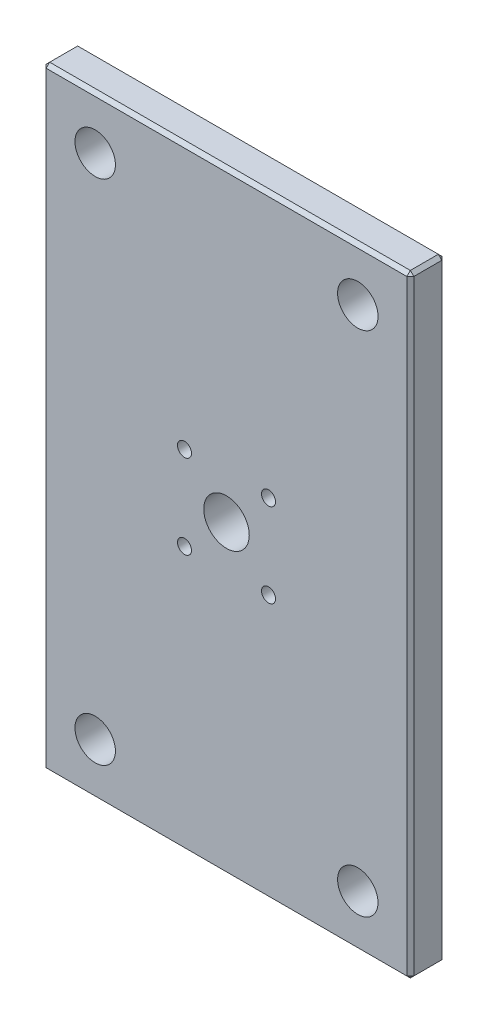
from build123d import *

# Parameters (mm, degrees)
SKETCH_1_W             = 420
SKETCH_1_H             = 700
EXTRUDE_1_DEPTH        = 40
SKETCH_2_R             = 23.1
CUT_EXTRUDE_1_DEPTH    = 818.312669668
SKETCH_3_R             = 26
CUT_EXTRUDE_2_DEPTH    = 818.312669668
M18X2_0_1_D            = 16
CHAMFER_1_SIZE         = 4
HOLE_WIZARD_M4_1_D     = 3.3
HOLE_WIZARD_M4_1_DEPTH = 10.1
HOLE_WIZARD_M4_1_TIP   = 0.991420021


with BuildPart() as part:
    # 草图1 → 凸台-拉伸1 (new body)
    with BuildSketch(Plane.XY):
        with Locations((210, 350)):
            Rectangle(SKETCH_1_W, SKETCH_1_H)
    extrude(amount=EXTRUDE_1_DEPTH)

    # 草图2 → 切除-拉伸1 (cut, through all)
    with BuildSketch(Plane.XY.offset(40)):
        with Locations((60, 60)):
            Circle(SKETCH_2_R)
        with Locations((360, 60)):
            Circle(SKETCH_2_R)
        with Locations((360, 640)):
            Circle(SKETCH_2_R)
        with Locations((60, 640)):
            Circle(SKETCH_2_R)
    extrude(amount=-CUT_EXTRUDE_1_DEPTH, mode=Mode.SUBTRACT)

    # 草图3 → 切除-拉伸2 (cut, through all)
    with BuildSketch(Plane.XY.offset(40)):
        with Locations((210, 350)):
            Circle(SKETCH_3_R)
    extrude(amount=-CUT_EXTRUDE_2_DEPTH, mode=Mode.SUBTRACT)

    # M18x2.0 螺纹孔1 (through all)
    with Locations(Plane.XY.offset(40)):
        with Locations((162, 398), (258, 398), (258, 302), (162, 302)):
            Hole(M18X2_0_1_D / 2)

    # 倒角1
    chamfer_1_edges = [part.edges().sort_by_distance(p)[0] for p in [
        (420, 350, 40),
        (210, 700, 40),
        (0, 350, 40),
        (210, 700, 0),
        (420, 350, 0),
        (210, 0, 0),
        (0, 350, 0),
        (210, 0, 40),
        (0, 700, 20),
        (420, 700, 20),
        (420, 0, 20),
        (0, 0, 20),
    ]]
    chamfer(chamfer_1_edges, length=CHAMFER_1_SIZE)

    # M4 螺纹孔1
    with Locations(Plane(origin=(0, 0, 0), x_dir=(-1, 0, 0), z_dir=(0, -1, 0))):
        with Locations((-237, -20), (-183, -20)):
            Hole(HOLE_WIZARD_M4_1_D / 2, depth=HOLE_WIZARD_M4_1_DEPTH)
            with Locations((0, 0, -(HOLE_WIZARD_M4_1_DEPTH + HOLE_WIZARD_M4_1_TIP / 2))):  # 118° drill point
                Cone(0, HOLE_WIZARD_M4_1_D / 2, HOLE_WIZARD_M4_1_TIP, mode=Mode.SUBTRACT)


solid = part.part
